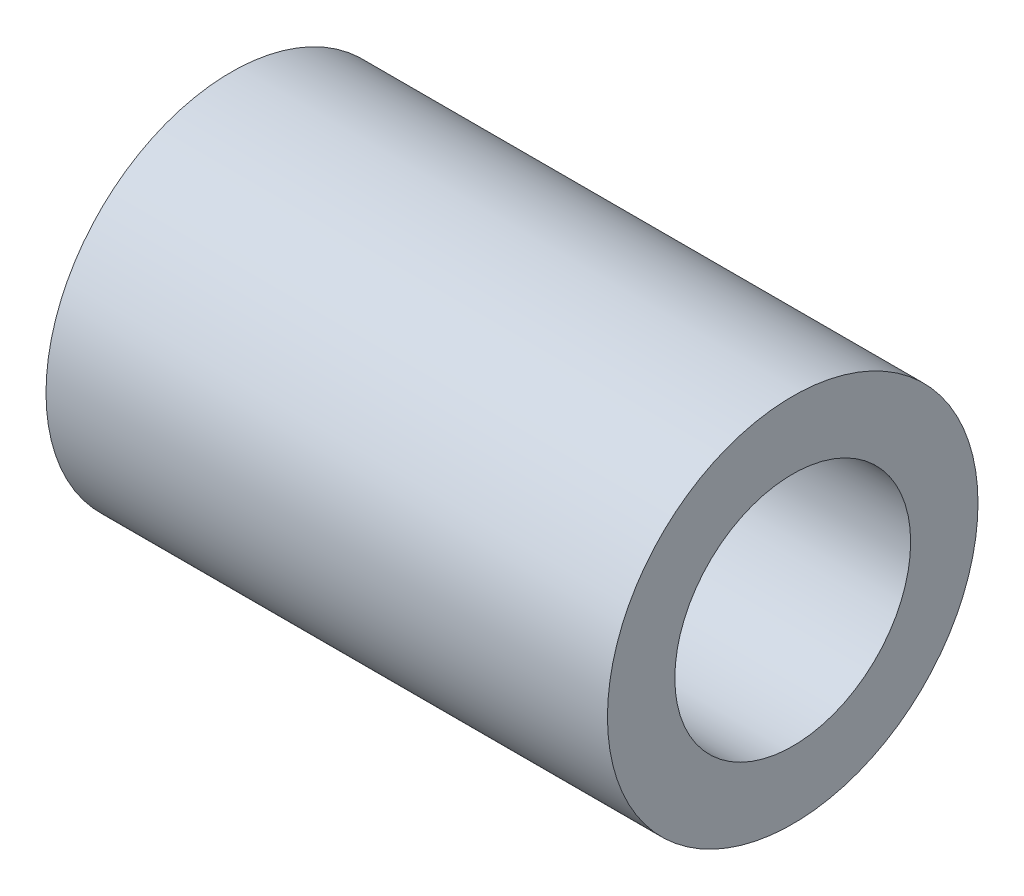
from build123d import *

# Parameters (mm, degrees)
SKETCH1_R           = 3.3
SKETCH1_R_2         = 2.1
BOSS_EXTRUDE1_DEPTH = 10


with BuildPart() as part:
    # Sketch1 → Boss-Extrude1 (new body)
    with BuildSketch(Plane(origin=(0, 0, 0), x_dir=(0, 0, -1), z_dir=(1, 0, 0))):
        Circle(SKETCH1_R)
        Circle(SKETCH1_R_2, mode=Mode.SUBTRACT)
    extrude(amount=BOSS_EXTRUDE1_DEPTH)


solid = part.part
